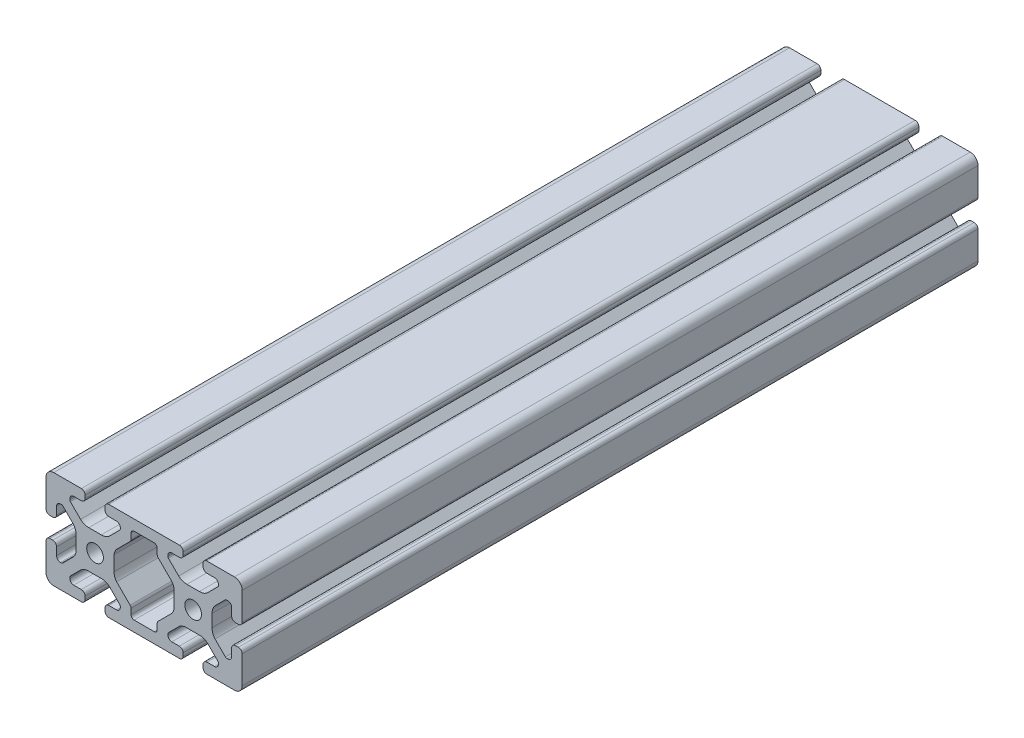
from build123d import *

# Parameters (mm, degrees)
SKETCH1_R      = 3.4
EXTRUDE1_DEPTH = 300


with BuildPart() as part:
    # Sketch1 → Extrude1 (new body)
    with BuildSketch(Plane.XY):
        with BuildLine():
            Line((-14.371895096, 20), (14.371895096, 20))
            ThreePointArc((14.371895096, 20), (15.50899084, 19.51254943), (15.94, 18.352883145))
            Line((15.94, 18.352883145), (15.94, 17.172883145))
            ThreePointArc((15.94, 17.172883145), (15.453758432, 16.112250378), (14.37, 15.68))
            Line((14.37, 15.68), (11.285, 15.68))
            ThreePointArc((11.285, 15.68), (10.174842354, 15.220157646), (9.715, 14.11))
            Line((9.715, 14.11), (9.715, 13.654503602))
            ThreePointArc((9.715, 13.654503602), (9.772851555, 13.363664194), (9.937598846, 13.117102448))
            Line((9.937598846, 13.117102448), (14.091872782, 8.962828513))
            ThreePointArc((14.091872782, 8.962828513), (15.647416634, 8.002049766), (17.450629992, 7.7))
            Line((17.450629992, 7.7), (22.549370008, 7.7))
            ThreePointArc((22.549370008, 7.7), (24.352583366, 8.002049766), (25.908127218, 8.962828513))
            Line((25.908127218, 8.962828513), (30.062401154, 13.117102448))
            ThreePointArc((30.062401154, 13.117102448), (30.227148445, 13.363664194), (30.285, 13.654503602))
            Line((30.285, 13.654503602), (30.285, 14.11))
            ThreePointArc((30.285, 14.11), (29.825157646, 15.220157646), (28.715, 15.68))
            Line((28.715, 15.68), (25.63, 15.68))
            ThreePointArc((25.63, 15.68), (24.519842354, 16.139842354), (24.06, 17.25))
            Line((24.06, 17.25), (24.06, 18.431164164))
            ThreePointArc((24.06, 18.431164164), (24.498672143, 19.519739968), (25.569550674, 20))
            Line((25.569550674, 20), (33, 20))
            Line((33, 20), (36.83, 20))
            ThreePointArc((36.83, 20), (39.067780363, 19.075288119), (40, 16.840624931))
            Line((40, 16.840624931), (40, 13.010624931))
            Line((40, 13.010624931), (40, 5.582508737))
            ThreePointArc((40, 5.582508737), (39.486387554, 4.464397964), (38.324306777, 4.06))
            Line((38.324306777, 4.06), (37.144306789, 4.06))
            ThreePointArc((37.144306789, 4.06), (36.103082753, 4.554299861), (35.68, 5.626438298))
            Line((35.68, 5.626438298), (35.68, 8.711438298))
            ThreePointArc((35.68, 8.711438298), (35.220157646, 9.821595945), (34.11, 10.281438298))
            Line((34.11, 10.281438298), (33.650941901, 10.281438298))
            ThreePointArc((33.650941901, 10.281438298), (33.360102492, 10.223586743), (33.113540747, 10.058839452))
            Line((33.113540747, 10.058839452), (29.01112516, 5.956423865))
            ThreePointArc((29.01112516, 5.956423865), (28.027864944, 4.392105869), (27.715866667, 2.570966522))
            Line((27.715866667, 2.570966522), (27.715866667, -2.502014759))
            ThreePointArc((27.715866667, -2.502014759), (27.988460835, -4.298258683), (28.915473265, -5.86077197))
            Line((28.915473265, -5.86077197), (33.171894658, -10.117193363))
            ThreePointArc((33.171894658, -10.117193363), (33.418456403, -10.281940654), (33.709295811, -10.339792209))
            Line((33.709295811, -10.339792209), (34.110956402, -10.339792209))
            ThreePointArc((34.110956402, -10.339792209), (35.240319888, -9.860405851), (35.68, -8.714999999))
            Line((35.68, -8.714999999), (35.68, -5.629999999))
            ThreePointArc((35.68, -5.629999999), (36.139842353, -4.519842353), (37.249999999, -4.06))
            Line((37.249999999, -4.06), (38.431164149, -4.06))
            ThreePointArc((38.431164149, -4.06), (39.519739962, -4.498672137), (40, -5.569550674))
            Line((40, -5.569550674), (40, -13))
            Line((40, -13), (40, -16.83))
            ThreePointArc((40, -16.83), (39.153330856, -18.99480488), (37.057427332, -20))
            Line((37.057427332, -20), (33.227427332, -20))
            Line((33.227427332, -20), (25.796978006, -20))
            ThreePointArc((25.796978006, -20), (24.580537154, -19.606606664), (24.06, -18.438904761))
            Line((24.06, -18.438904761), (24.06, -17.25))
            ThreePointArc((24.06, -17.25), (24.519842354, -16.139842354), (25.63, -15.68))
            Line((25.63, -15.68), (28.715, -15.68))
            ThreePointArc((28.715, -15.68), (29.825157646, -15.220157646), (30.285, -14.11))
            Line((30.285, -14.11), (30.285, -13.654503602))
            ThreePointArc((30.285, -13.654503602), (30.227148445, -13.363664194), (30.062401154, -13.117102448))
            Line((30.062401154, -13.117102448), (26.309520343, -9.364221638))
            ThreePointArc((26.309520343, -9.364221638), (24.979669869, -8.257223741), (23.341546451, -7.7))
            Line((23.341546451, -7.7), (16.658453549, -7.7))
            ThreePointArc((16.658453549, -7.7), (15.020330131, -8.257223741), (13.690479657, -9.364221638))
            Line((13.690479657, -9.364221638), (9.937598846, -13.117102448))
            ThreePointArc((9.937598846, -13.117102448), (9.772851555, -13.363664194), (9.715, -13.654503602))
            Line((9.715, -13.654503602), (9.715, -14.11))
            ThreePointArc((9.715, -14.11), (10.174842354, -15.220157646), (11.285, -15.68))
            Line((11.285, -15.68), (14.37, -15.68))
            ThreePointArc((14.37, -15.68), (15.480157646, -16.139842354), (15.94, -17.25))
            Line((15.94, -17.25), (15.94, -18.43))
            ThreePointArc((15.94, -18.43), (15.480157646, -19.540157646), (14.37, -20))
            Line((14.37, -20), (5.99100603, -20))
            Line((5.99100603, -20), (-1.780052417, -20))
            Line((-1.780052417, -20), (-5.99100603, -20))
            Line((-5.99100603, -20), (-14.37, -20))
            ThreePointArc((-14.37, -20), (-15.480157646, -19.540157646), (-15.94, -18.43))
            Line((-15.94, -18.43), (-15.94, -17.25))
            ThreePointArc((-15.94, -17.25), (-15.480157646, -16.139842354), (-14.37, -15.68))
            Line((-14.37, -15.68), (-11.285, -15.68))
            ThreePointArc((-11.285, -15.68), (-10.174842354, -15.220157646), (-9.715, -14.11))
            Line((-9.715, -14.11), (-9.715, -13.654503602))
            ThreePointArc((-9.715, -13.654503602), (-9.772851555, -13.363664194), (-9.937598846, -13.117102448))
            Line((-9.937598846, -13.117102448), (-13.690479657, -9.364221638))
            ThreePointArc((-13.690479657, -9.364221638), (-15.020330131, -8.257223741), (-16.658453549, -7.7))
            Line((-16.658453549, -7.7), (-23.341546451, -7.7))
            ThreePointArc((-23.341546451, -7.7), (-24.979669869, -8.257223741), (-26.309520343, -9.364221638))
            Line((-26.309520343, -9.364221638), (-30.062401154, -13.117102448))
            ThreePointArc((-30.062401154, -13.117102448), (-30.227148445, -13.363664194), (-30.285, -13.654503602))
            Line((-30.285, -13.654503602), (-30.285, -14.11))
            ThreePointArc((-30.285, -14.11), (-29.825157646, -15.220157646), (-28.715, -15.68))
            Line((-28.715, -15.68), (-25.63, -15.68))
            ThreePointArc((-25.63, -15.68), (-24.519842354, -16.139842354), (-24.06, -17.25))
            Line((-24.06, -17.25), (-24.06, -18.438904761))
            ThreePointArc((-24.06, -18.438904761), (-24.580537154, -19.606606664), (-25.796978006, -20))
            Line((-25.796978006, -20), (-33.227427332, -20))
            Line((-33.227427332, -20), (-37.057427332, -20))
            ThreePointArc((-37.057427332, -20), (-39.153330856, -18.99480488), (-40, -16.83))
            Line((-40, -16.83), (-40, -13))
            Line((-40, -13), (-40, -5.569550674))
            ThreePointArc((-40, -5.569550674), (-39.519739962, -4.498672137), (-38.431164149, -4.06))
            Line((-38.431164149, -4.06), (-37.249999999, -4.06))
            ThreePointArc((-37.249999999, -4.06), (-36.139842353, -4.519842353), (-35.68, -5.629999999))
            Line((-35.68, -5.629999999), (-35.68, -8.714999999))
            ThreePointArc((-35.68, -8.714999999), (-35.240319888, -9.860405851), (-34.110956402, -10.339792209))
            Line((-34.110956402, -10.339792209), (-33.709295811, -10.339792209))
            ThreePointArc((-33.709295811, -10.339792209), (-33.418456403, -10.281940654), (-33.171894658, -10.117193363))
            Line((-33.171894658, -10.117193363), (-28.915473265, -5.86077197))
            ThreePointArc((-28.915473265, -5.86077197), (-27.988460835, -4.298258683), (-27.715866667, -2.502014759))
            Line((-27.715866667, -2.502014759), (-27.715866667, 2.570966522))
            ThreePointArc((-27.715866667, 2.570966522), (-28.027864944, 4.392105869), (-29.01112516, 5.956423865))
            Line((-29.01112516, 5.956423865), (-33.113540747, 10.058839452))
            ThreePointArc((-33.113540747, 10.058839452), (-33.360102492, 10.223586743), (-33.650941901, 10.281438298))
            Line((-33.650941901, 10.281438298), (-34.11, 10.281438298))
            ThreePointArc((-34.11, 10.281438298), (-35.220157646, 9.821595945), (-35.68, 8.711438298))
            Line((-35.68, 8.711438298), (-35.68, 5.626438298))
            ThreePointArc((-35.68, 5.626438298), (-36.103082753, 4.554299861), (-37.144306789, 4.06))
            Line((-37.144306789, 4.06), (-38.324306777, 4.06))
            ThreePointArc((-38.324306777, 4.06), (-39.486387554, 4.464397964), (-40, 5.582508737))
            Line((-40, 5.582508737), (-40, 13.010624931))
            Line((-40, 13.010624931), (-40, 16.840624931))
            ThreePointArc((-40, 16.840624931), (-39.067780363, 19.075288119), (-36.83, 20))
            Line((-36.83, 20), (-33, 20))
            Line((-33, 20), (-25.569550674, 20))
            ThreePointArc((-25.569550674, 20), (-24.498672143, 19.519739968), (-24.06, 18.431164164))
            Line((-24.06, 18.431164164), (-24.06, 17.25))
            ThreePointArc((-24.06, 17.25), (-24.519842354, 16.139842354), (-25.63, 15.68))
            Line((-25.63, 15.68), (-28.715, 15.68))
            ThreePointArc((-28.715, 15.68), (-29.825157646, 15.220157646), (-30.285, 14.11))
            Line((-30.285, 14.11), (-30.285, 13.654503602))
            ThreePointArc((-30.285, 13.654503602), (-30.227148445, 13.363664194), (-30.062401154, 13.117102448))
            Line((-30.062401154, 13.117102448), (-25.908127218, 8.962828513))
            ThreePointArc((-25.908127218, 8.962828513), (-24.352583366, 8.002049766), (-22.549370008, 7.7))
            Line((-22.549370008, 7.7), (-17.450629992, 7.7))
            ThreePointArc((-17.450629992, 7.7), (-15.647416634, 8.002049766), (-14.091872782, 8.962828513))
            Line((-14.091872782, 8.962828513), (-9.937598846, 13.117102448))
            ThreePointArc((-9.937598846, 13.117102448), (-9.772851555, 13.363664194), (-9.715, 13.654503602))
            Line((-9.715, 13.654503602), (-9.715, 14.11))
            ThreePointArc((-9.715, 14.11), (-10.174842354, 15.220157646), (-11.285, 15.68))
            Line((-11.285, 15.68), (-14.37, 15.68))
            ThreePointArc((-14.37, 15.68), (-15.453758432, 16.112250378), (-15.94, 17.172883145))
            Line((-15.94, 17.172883145), (-15.94, 18.352883145))
            ThreePointArc((-15.94, 18.352883145), (-15.50899084, 19.51254943), (-14.371895096, 20))
        make_face()
        with Locations((-20, 0)):
            Circle(SKETCH1_R, mode=Mode.SUBTRACT)
        with Locations(Location((20, 0, 0), (0, 0, 180))):
            Circle(SKETCH1_R, mode=Mode.SUBTRACT)
        with BuildLine():
            Line((4.071751167, 15.68), (-4.071751167, 15.68))
            ThreePointArc((-4.071751167, 15.68), (-4.969776779, 15.308025612), (-5.341751167, 14.41))
            Line((-5.341751167, 14.41), (-5.341751167, 12.129598762))
            ThreePointArc((-5.341751167, 12.129598762), (-5.438424161, 11.643590803), (-5.713725555, 11.23157315))
            Line((-5.713725555, 11.23157315), (-10.598777023, 6.346521682))
            ThreePointArc((-10.598777023, 6.346521682), (-11.737774423, 4.964558417), (-12.284133333, 3.259087959))
            Line((-12.284133333, 3.259087959), (-12.284133333, -2.724972544))
            ThreePointArc((-12.284133333, -2.724972544), (-12.005210609, -4.328708179), (-11.201199443, -5.744099262))
            Line((-11.201199443, -5.744099262), (-5.713725555, -11.23157315))
            ThreePointArc((-5.713725555, -11.23157315), (-5.438424161, -11.643590803), (-5.341751167, -12.129598762))
            Line((-5.341751167, -12.129598762), (-5.341751167, -14.41))
            ThreePointArc((-5.341751167, -14.41), (-4.969776779, -15.308025612), (-4.071751167, -15.68))
            Line((-4.071751167, -15.68), (4.071751167, -15.68))
            ThreePointArc((4.071751167, -15.68), (4.969776779, -15.308025612), (5.341751167, -14.41))
            Line((5.341751167, -14.41), (5.341751167, -12.129598762))
            ThreePointArc((5.341751167, -12.129598762), (5.438424161, -11.643590803), (5.713725555, -11.23157315))
            Line((5.713725555, -11.23157315), (11.201199443, -5.744099262))
            ThreePointArc((11.201199443, -5.744099262), (12.005210609, -4.328708179), (12.284133333, -2.724972544))
            Line((12.284133333, -2.724972544), (12.284133333, 3.259087959))
            ThreePointArc((12.284133333, 3.259087959), (11.737774423, 4.964558417), (10.598777023, 6.346521682))
            Line((10.598777023, 6.346521682), (5.713725555, 11.23157315))
            ThreePointArc((5.713725555, 11.23157315), (5.438424161, 11.643590803), (5.341751167, 12.129598762))
            Line((5.341751167, 12.129598762), (5.341751167, 14.41))
            ThreePointArc((5.341751167, 14.41), (4.969776779, 15.308025612), (4.071751167, 15.68))
        make_face(mode=Mode.SUBTRACT)
    extrude(amount=-EXTRUDE1_DEPTH)


solid = part.part
